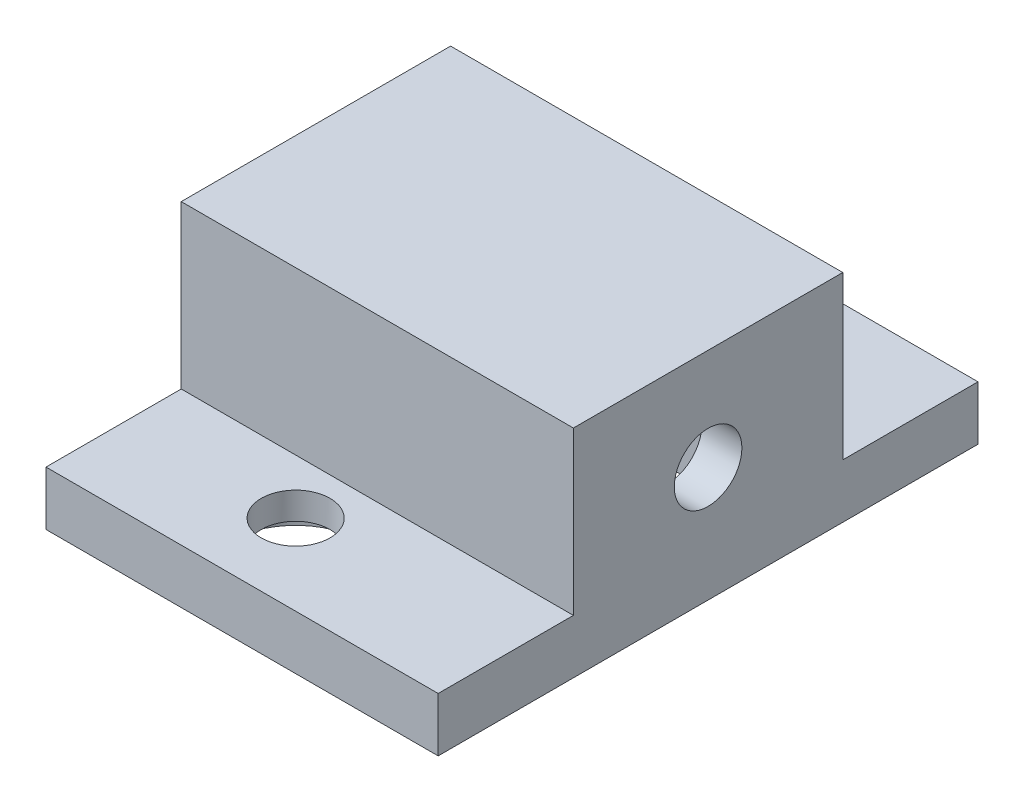
from build123d import *

# Parameters (mm, degrees)
EXTRUDE_1_DEPTH          = 6.5
EXTRUDE_2_DEPTH          = 1.5
SKETCH_3_R               = 1.25
CUT_EXTRUDE_1_DEPTH      = 21.211382931
SKETCH_4_W               = 16.5
SKETCH_4_H               = 5
EXTRUDE_3_DEPTH          = 2
SKETCH_5_R               = 1.25
CUT_EXTRUDE_2_DEPTH      = 10
SKETCH_6_R               = 2.5
CUT_EXTRUDE_3_DEPTH      = 1
CUT_EXTRUDE_4_DEPTH      = 23.14723459
CUT_EXTRUDE_4_DEPTH_BACK = 23.14723459
SKETCH_7_R               = 1.27
CUT_EXTRUDE_5_DEPTH      = 23.14723459
CUT_EXTRUDE_5_DEPTH_BACK = 23.14723459
SKETCH_8_W               = 16.5
SKETCH_8_H               = 0.229721737
SKETCH_8_H_2             = 0.3558102
CUT_EXTRUDE_6_DEPTH      = 23.758743375
CUT_EXTRUDE_6_DEPTH_BACK = 6
SKETCH_9_W               = 16.5
SKETCH_9_H               = 0.02
SKETCH_10_W              = 15.04
SKETCH_10_H              = 7.04
CUT_EXTRUDE_7_DEPTH      = 6.5
SKETCH_11_W              = 27.526079408
SKETCH_11_H              = 12.932606898
CUT_EXTRUDE_8_DEPTH      = 2


with BuildPart() as part:
    # 草图1 → 凸台-拉伸1 (new body)
    with BuildSketch(Plane(origin=(0, 0, 0), x_dir=(1, 0, 0), z_dir=(0, 1, 0))):
        Polygon((0, 1.5), (16.5, 1.5), (16.5, -8.5), (0, -8.5), (0, -7), (15, -7), (15, 0), (0, 0), align=None)
    extrude(amount=EXTRUDE_1_DEPTH)

    # 草图2 → 凸台-拉伸2 (add)
    with BuildSketch(Plane(origin=(0, 6.5, 0), x_dir=(1, 0, 0), z_dir=(0, 1, 0))):
        Polygon((0, 0), (0, -7), (0, -8.5), (16.5, -8.5), (16.5, 1.5), (0, 1.5), align=None)
    extrude(amount=EXTRUDE_2_DEPTH)

    # 草图3 → 切除-拉伸1 (cut, through all)
    with BuildSketch(Plane(origin=(16.5, 0, 0), x_dir=(0, 0, -1), z_dir=(1, 0, 0))):
        with Locations((-3.5, 4.25)):
            Circle(SKETCH_3_R)
    extrude(amount=-CUT_EXTRUDE_1_DEPTH, mode=Mode.SUBTRACT)

    # 草图4 → 凸台-拉伸3 (add)
    with BuildSketch(Plane.XZ):
        with Locations((8.25, 11)):
            Rectangle(SKETCH_4_W, SKETCH_4_H)
        with Locations((8.25, -4)):
            Rectangle(SKETCH_4_W, SKETCH_4_H)
    extrude(amount=-EXTRUDE_3_DEPTH)

    # 草图5 → 切除-拉伸2 (cut)
    with BuildSketch(Plane.XZ):
        with Locations(Location((8.25, 10.5, 0), (0, 0, 270))):
            Circle(SKETCH_5_R)
        with Locations(Location((8.25, -3.5, 0), (0, 0, 270))):
            Circle(SKETCH_5_R)
    extrude(amount=-CUT_EXTRUDE_2_DEPTH, mode=Mode.SUBTRACT)

    # 草图6 → 切除-拉伸3 (cut)
    with BuildSketch(Plane.XZ):
        with Locations(Location((8.25, 10.5, 0), (0, 0, 270))):
            Circle(SKETCH_6_R)
        with Locations(Location((8.25, -3.5, 0), (0, 0, 270))):
            Circle(SKETCH_6_R)
    extrude(amount=-CUT_EXTRUDE_3_DEPTH, mode=Mode.SUBTRACT)

    # 草图7 → 切除-拉伸4 (cut, two sides: drawn at the far end of the back side and taken through both)
    with BuildSketch(Plane(origin=(0, 2, 0), x_dir=(1, 0, 0), z_dir=(0, 1, 0)).offset(-CUT_EXTRUDE_4_DEPTH_BACK)):
        with Locations(Location((8.25, 3.5, 0), (0, 0, 270))):
            Circle(SKETCH_7_R)
        with Locations(Location((8.25, -10.5, 0), (0, 0, 270))):
            Circle(SKETCH_7_R)
    extrude(amount=CUT_EXTRUDE_4_DEPTH + CUT_EXTRUDE_4_DEPTH_BACK, mode=Mode.SUBTRACT)

    # 草图8 → 切除-拉伸5 (cut, two sides: drawn at the far end of the back side and taken through both)
    with BuildSketch(Plane(origin=(0, 2, 0), x_dir=(1, 0, 0), z_dir=(0, 1, 0)).offset(-CUT_EXTRUDE_5_DEPTH_BACK)):
        with Locations((8.25, 6.594860869)):
            Rectangle(SKETCH_8_W, SKETCH_8_H)
        with Locations((8.25, -13.6579051)):
            Rectangle(SKETCH_8_W, SKETCH_8_H_2)
    extrude(amount=CUT_EXTRUDE_5_DEPTH + CUT_EXTRUDE_5_DEPTH_BACK, mode=Mode.SUBTRACT)

    # 草图9 → 切除-拉伸6 (cut, two sides: drawn at the far end of the back side and taken through both)
    with BuildSketch(Plane(origin=(0, 8, 0), x_dir=(1, 0, 0), z_dir=(0, 1, 0)).offset(-CUT_EXTRUDE_6_DEPTH_BACK)):
        with Locations((8.25, -8.49)):
            Rectangle(SKETCH_9_W, SKETCH_9_H)
        with Locations((8.25, 1.49)):
            Rectangle(SKETCH_9_W, SKETCH_9_H)
    extrude(amount=CUT_EXTRUDE_6_DEPTH + CUT_EXTRUDE_6_DEPTH_BACK, mode=Mode.SUBTRACT)

    # 草图10 → 切除-拉伸7 (cut)
    with BuildSketch(Plane.XZ.offset(-6.5)):
        with Locations((7.5, 3.5)):
            Rectangle(SKETCH_10_W, SKETCH_10_H)
    extrude(amount=CUT_EXTRUDE_7_DEPTH, mode=Mode.SUBTRACT)

    # 草图11 → 切除-拉伸8 (cut)
    with BuildSketch(Plane.ZY):
        with Locations((5.08335855, 3.634609565)):
            Rectangle(SKETCH_11_W, SKETCH_11_H)
    extrude(amount=-CUT_EXTRUDE_8_DEPTH, mode=Mode.SUBTRACT)


solid = part.part
